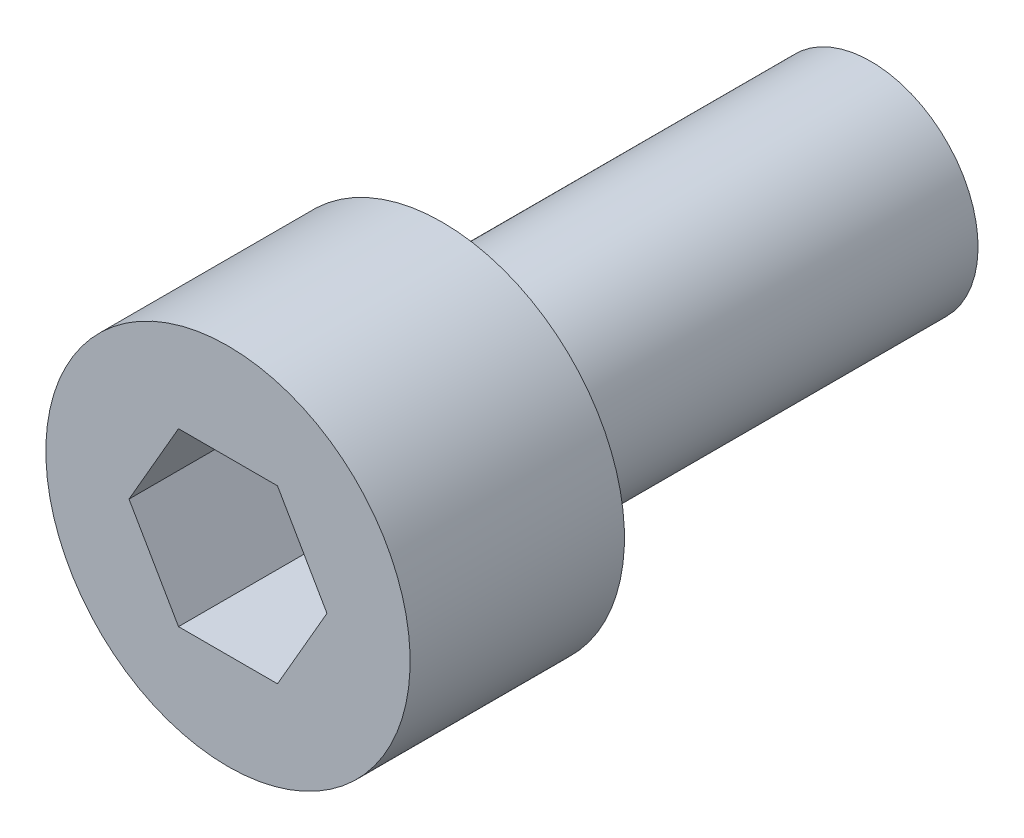
from build123d import *

# Parameters (mm, degrees)
CUT_EXTRUDE1_DEPTH = 3


with BuildPart() as part:
    # Sketch1 → Revolve1 (revolve)
    with BuildSketch(Plane(origin=(0, 0, 0), x_dir=(0, 0, -1), z_dir=(1, 0, 0))):
        Polygon((-5, 0), (-5, 4.25), (0, 4.25), (0, 2.5), (10, 2.5), (10, 0), align=None)
    revolve(axis=Axis((0, 0, 5.584882278), (0, 0, -1)))

    # Sketch2 → Cut-Extrude1 (cut)
    with BuildSketch(Plane.XY.offset(5)):
        Polygon((1.154700538, -2), (2.309401077, 0), (1.154700538, 2), (-1.154700538, 2), (-2.309401077, 0), (-1.154700538, -2), align=None)
    extrude(amount=-CUT_EXTRUDE1_DEPTH, mode=Mode.SUBTRACT)


solid = part.part
